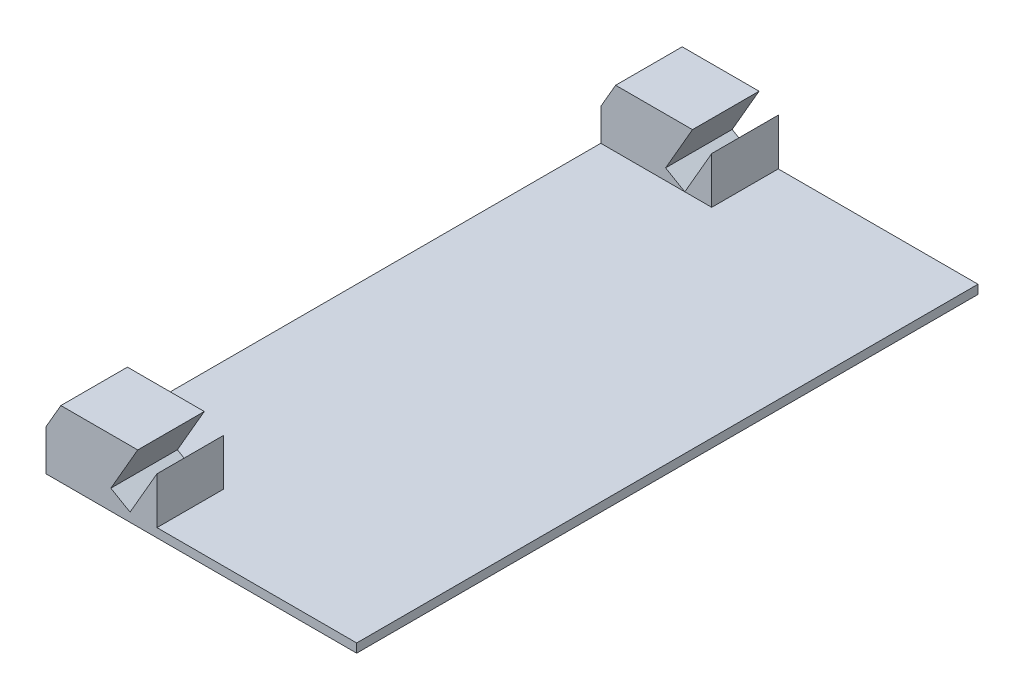
from build123d import *

# Parameters (mm, degrees)
SKIZZE1_W                       = 70
SKIZZE1_H                       = 140
AUFSATZ_LINEAR_AUSTRAGEN1_DEPTH = 2
SKIZZE2_W                       = 25
SKIZZE2_H                       = 15
AUFSATZ_LINEAR_AUSTRAGEN2_DEPTH = 13
SCHNITT_LINEAR_AUSTRAGEN1_DEPTH = 146.086181285


with BuildPart() as part:
    # Skizze1 → Aufsatz-Linear austragen1 (new body)
    with BuildSketch(Plane(origin=(0, 0, 0), x_dir=(1, 0, 0), z_dir=(0, 1, 0))):
        Rectangle(SKIZZE1_W, SKIZZE1_H)
    extrude(amount=AUFSATZ_LINEAR_AUSTRAGEN1_DEPTH)

    # Skizze2 → Aufsatz-Linear austragen2 (add)
    with BuildSketch(Plane(origin=(0, 2, 0), x_dir=(1, 0, 0), z_dir=(0, 1, 0))):
        with Locations((-22.5, 62.5)):
            Rectangle(SKIZZE2_W, SKIZZE2_H)
        with Locations((-22.5, -62.5)):
            Rectangle(SKIZZE2_W, SKIZZE2_H)
    extrude(amount=AUFSATZ_LINEAR_AUSTRAGEN2_DEPTH)

    # Skizze3 → Schnitt-Linear austragen1 (cut, through all)
    with BuildSketch(Plane.XY.offset(70)):
        Polygon((-35, 15), (-35, 9.198729811), (-31.650635095, 15), align=None)
        Polygon((-14.330127019, 15), (-20.392304845, 4.5), (-16.062177826, 2), (-10, 12.5), (-10, 15), align=None)
    extrude(amount=-SCHNITT_LINEAR_AUSTRAGEN1_DEPTH, mode=Mode.SUBTRACT)


solid = part.part
